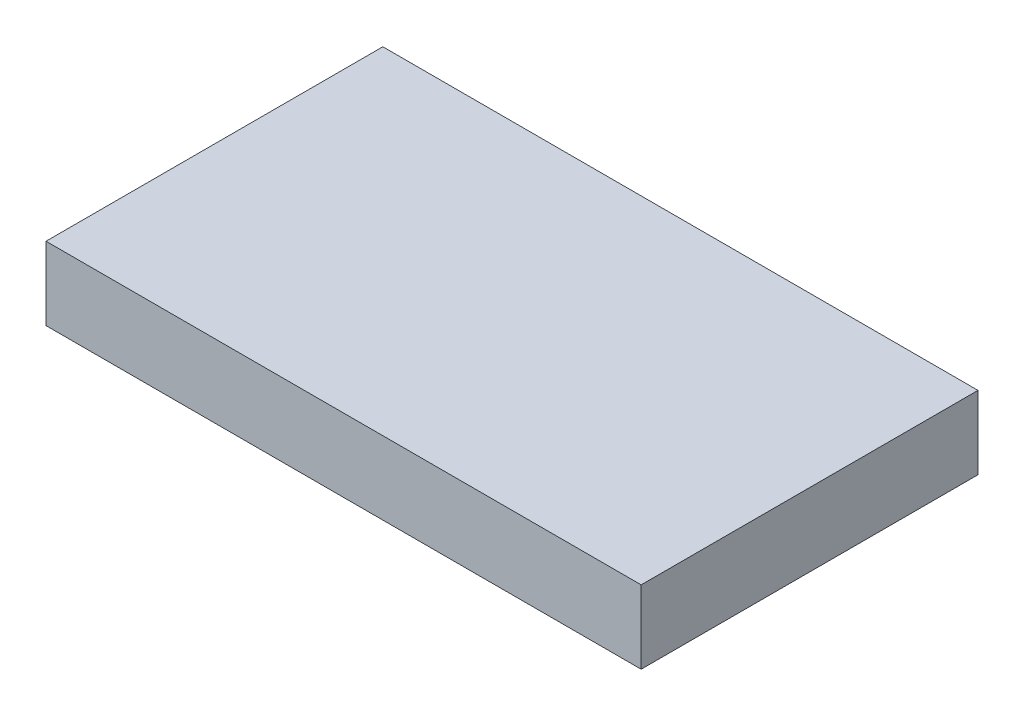
from build123d import *

# Parameters (mm, degrees)
SKETCH1_W           = 482
SKETCH1_H           = 272.8
BOSS_EXTRUDE1_DEPTH = 59.2


with BuildPart() as part:
    # Sketch1 → Boss-Extrude1 (new body)
    with BuildSketch(Plane(origin=(0, 0, 0), x_dir=(1, 0, 0), z_dir=(0, 1, 0))):
        Rectangle(SKETCH1_W, SKETCH1_H)
    extrude(amount=BOSS_EXTRUDE1_DEPTH)


solid = part.part
